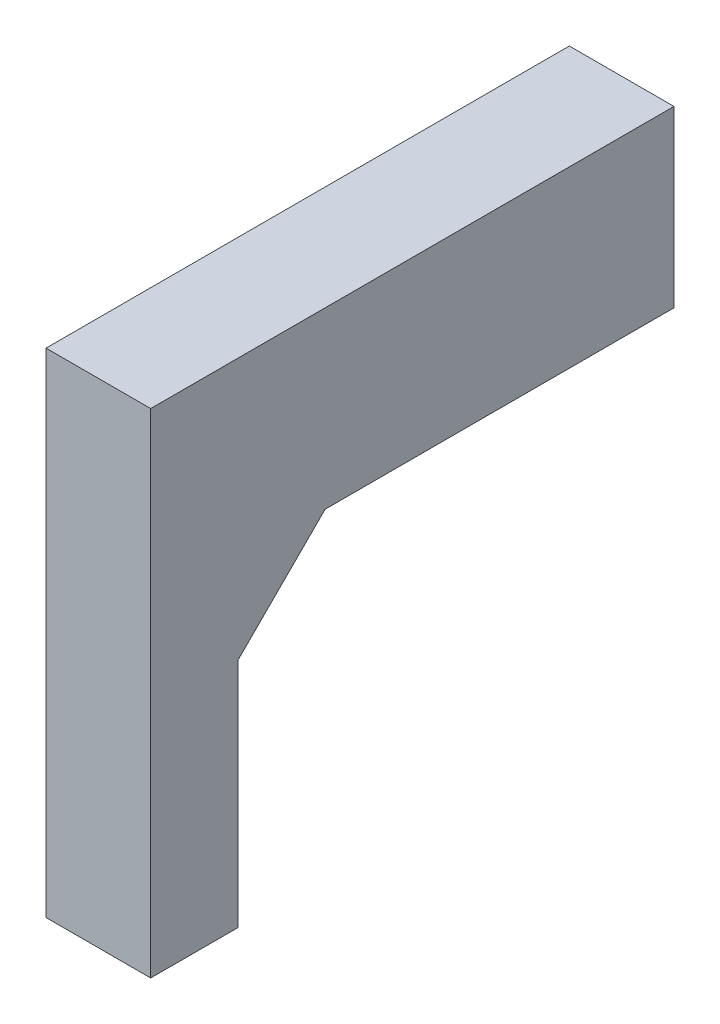
from build123d import *

# Parameters (mm, degrees)
BOSS_EXTRUDE1_DEPTH = 30


with BuildPart() as part:
    # Sketch1 → Boss-Extrude1 (new body)
    with BuildSketch(Plane.YZ):
        Polygon((0, 0), (-50, 0), (-50, 100), (-74.960869376, 124.960869376), (-141.360869376, 124.960869376), (-141.360869376, 150), (0, 150), align=None)
    extrude(amount=BOSS_EXTRUDE1_DEPTH)


solid = part.part
